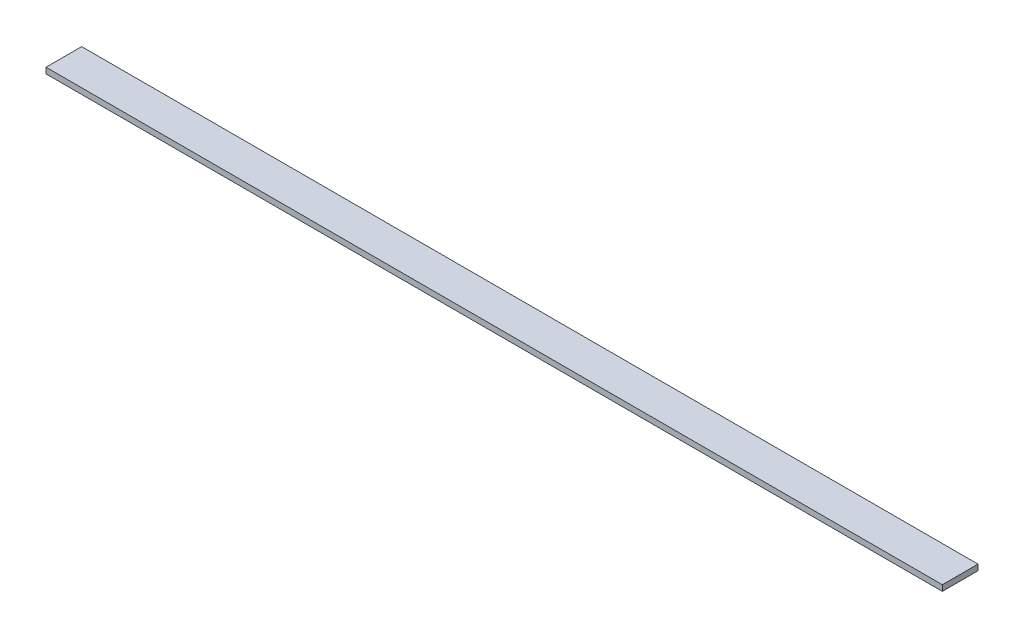
from build123d import *

# Parameters (mm, degrees)
SKETCH3_W           = 5905.5
SKETCH3_H           = 234.95
BOSS_EXTRUDE1_DEPTH = 38.1


with BuildPart() as part:
    # Sketch3 → Boss-Extrude1 (new body)
    with BuildSketch(Plane(origin=(0, 0, 0), x_dir=(1, 0, 0), z_dir=(0, 1, 0))):
        with Locations((-858.661111111, 1546.754166667)):
            Rectangle(SKETCH3_W, SKETCH3_H)
    extrude(amount=BOSS_EXTRUDE1_DEPTH)


solid = part.part
